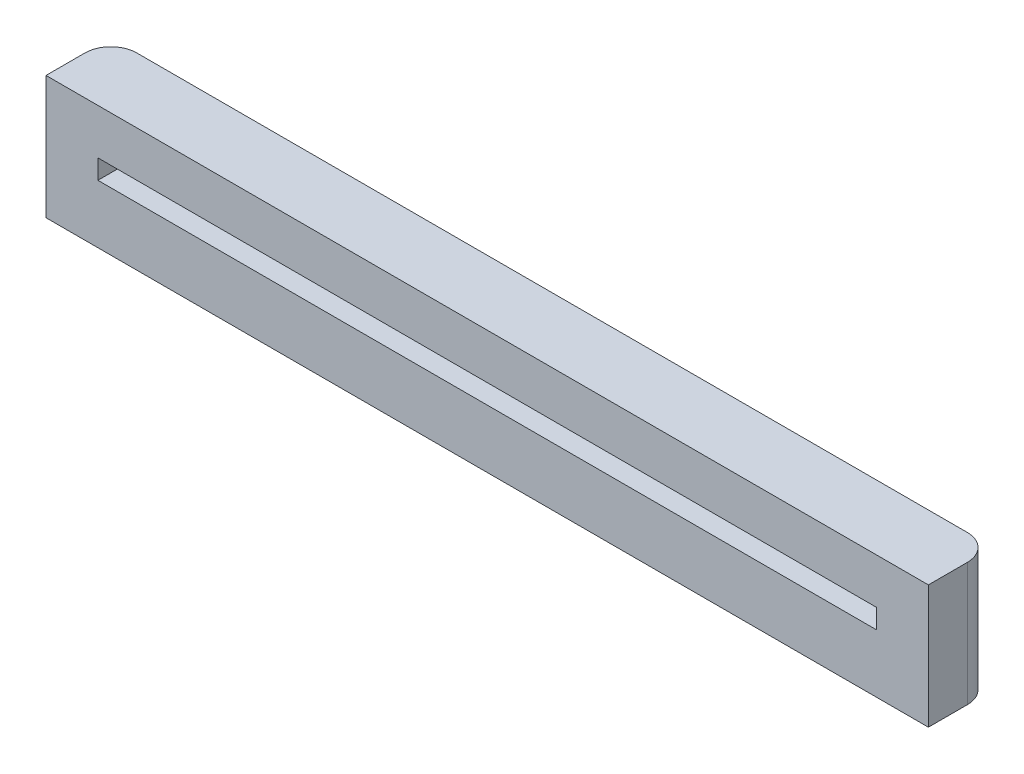
from build123d import *

# Parameters (mm, degrees)
SKETCH1_W           = 68
SKETCH1_H           = 9.5
BOSS_EXTRUDE1_DEPTH = 5
SKETCH2_W           = 60
SKETCH2_H           = 1.5
CUT_EXTRUDE1_DEPTH  = 3
FILLET1_R           = 2


with BuildPart() as part:
    # Sketch1 → Boss-Extrude1 (new body)
    with BuildSketch(Plane.XY):
        with Locations((34, 4.75)):
            Rectangle(SKETCH1_W, SKETCH1_H)
    extrude(amount=BOSS_EXTRUDE1_DEPTH)

    # Sketch2 → Cut-Extrude1 (cut)
    with BuildSketch(Plane.XY.offset(5)):
        with Locations((34, 5.25)):
            Rectangle(SKETCH2_W, SKETCH2_H)
    extrude(amount=-CUT_EXTRUDE1_DEPTH, mode=Mode.SUBTRACT)

    # Fillet1
    fillet1_edges = [part.edges().sort_by_distance(p)[0] for p in [
        (68, 4.75, 0),
        (0, 4.75, 0),
    ]]
    fillet(fillet1_edges, radius=FILLET1_R)


solid = part.part
